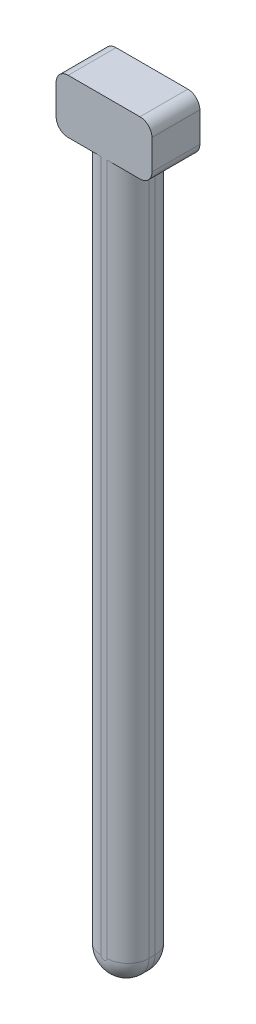
from build123d import *

# Parameters (mm, degrees)
BOSS_EXTRUDE1_DEPTH = 4
FILLET1_R           = 1.75
FILLET2_R           = 1


with BuildPart() as part:
    # Sketch1 → Boss-Extrude1 (new body)
    with BuildSketch(Plane.XY):
        with BuildLine():
            Line((2, -2.25), (-2, -2.25))
            Line((-2, -2.25), (-2, -60))
            ThreePointArc((-2, -60), (0, -62), (2, -60))
            Line((2, -60), (2, -2.25))
        make_face()
        with BuildLine():
            Line((-2, 0), (-2, -2.25))
            Line((-2, -2.25), (2, -2.25))
            Line((2, -2.25), (2, 0))
            ThreePointArc((2, 0), (0, 2), (-2, 0))
        make_face()
        with BuildLine():
            Line((-4, 2.25), (-4, -2.25))
            Line((-4, -2.25), (-2, -2.25))
            Line((-2, -2.25), (-2, 0))
            ThreePointArc((-2, 0), (0, 2), (2, 0))
            Line((2, 0), (2, -2.25))
            Line((2, -2.25), (4, -2.25))
            Line((4, -2.25), (4, 2.25))
            Line((4, 2.25), (-4, 2.25))
        make_face()
    extrude(amount=BOSS_EXTRUDE1_DEPTH)

    # Fillet1
    fillet1_edges = [part.edges().sort_by_distance(p)[0] for p in [
        (2, -31.125, 0),
        (0, -62, 0),
        (-2, -31.125, 0),
        (0, -62, 4),
        (2, -31.125, 4),
        (-2, -31.125, 4),
    ]]
    fillet(fillet1_edges, radius=FILLET1_R)

    # Fillet2
    fillet2_edges = [part.edges().sort_by_distance(p)[0] for p in [
        (-4, -2.25, 2),
        (-4, 2.25, 2),
        (4, 2.25, 2),
        (4, -2.25, 2),
    ]]
    fillet(fillet2_edges, radius=FILLET2_R)


solid = part.part
